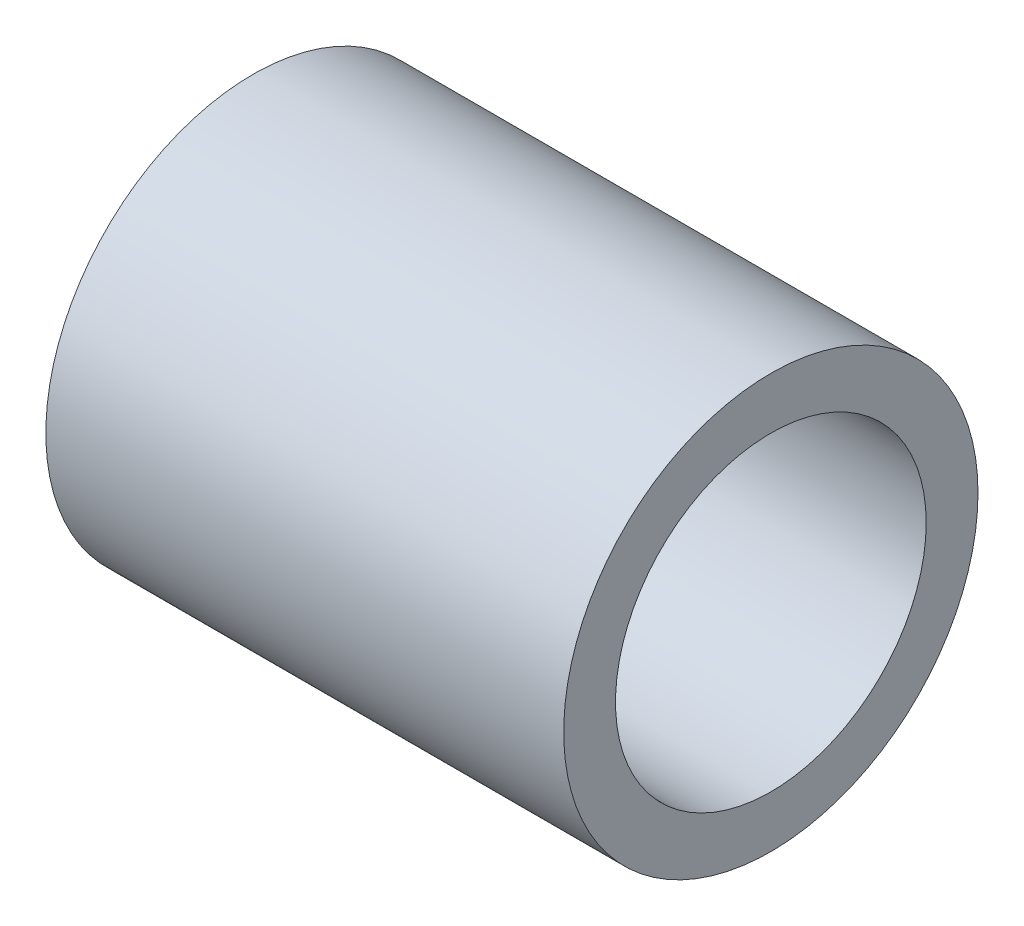
from build123d import *

# Parameters (mm, degrees)
SKETCH1_R           = 8
BOSS_EXTRUDE1_DEPTH = 20
SKETCH2_R           = 6
CUT_EXTRUDE1_DEPTH  = 40


with BuildPart() as part:
    # Sketch1 → Boss-Extrude1 (new body)
    with BuildSketch(Plane(origin=(521, 0, 0), x_dir=(0, 0, -1), z_dir=(1, 0, 0))):
        with Locations((-157, 300)):
            Circle(SKETCH1_R)
    extrude(amount=BOSS_EXTRUDE1_DEPTH)

    # Sketch2 → Cut-Extrude1 (cut)
    with BuildSketch(Plane(origin=(541, 0, 0), x_dir=(0, 0, -1), z_dir=(1, 0, 0))):
        with Locations((-157, 300)):
            Circle(SKETCH2_R)
    extrude(amount=-CUT_EXTRUDE1_DEPTH, mode=Mode.SUBTRACT)


solid = part.part
